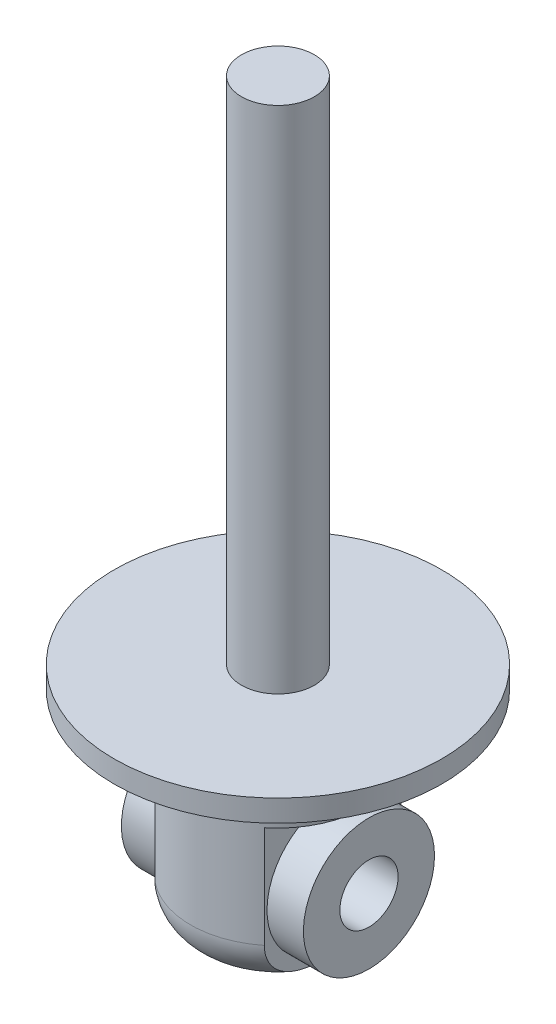
from build123d import *

# Parameters (mm, degrees)
SKETCH2_R               = 22.5
BOSS_EXTRUDE1_DEPTH     = 3
SKETCH3_R               = 5
BOSS_EXTRUDE2_DEPTH     = 70
SKETCH4_R               = 12
BOSS_EXTRUDE3_DEPTH     = 28
FILLET1_R               = 6
CUT_EXTRUDE1_DEPTH      = 80.633535649
CUT_EXTRUDE1_DEPTH_BACK = 80.633535649
SKETCH5_W               = 32.323012781
SKETCH5_H               = 20
CUT_EXTRUDE2_DEPTH      = 83.068568892
CUT_EXTRUDE2_DEPTH_BACK = 83.068568892
SKETCH6_R               = 4
SKETCH7_R               = 9
SKETCH7_R_2             = 4
BOSS_EXTRUDE4_DEPTH     = 12.5


with BuildPart() as part:
    # Sketch2 → Boss-Extrude1 (new body)
    with BuildSketch(Plane(origin=(0, 0, 0), x_dir=(1, 0, 0), z_dir=(0, 1, 0))):
        with Locations(Location((0, 0, 0), (0, 0, 270))):
            Circle(SKETCH2_R)
    extrude(amount=BOSS_EXTRUDE1_DEPTH)

    # Sketch3 → Boss-Extrude2 (add)
    with BuildSketch(Plane(origin=(0, 3, 0), x_dir=(1, 0, 0), z_dir=(0, 1, 0))):
        with Locations(Location((0, 0, 0), (0, 0, 270))):
            Circle(SKETCH3_R)
    extrude(amount=BOSS_EXTRUDE2_DEPTH)

    # Sketch4 → Boss-Extrude3 (add)
    with BuildSketch(Plane.XZ):
        with Locations(Location((0, 0, 0), (0, 0, 270))):
            Circle(SKETCH4_R)
    extrude(amount=BOSS_EXTRUDE3_DEPTH)

    # Fillet1
    fillet1_edges = [part.edges().sort_by_distance(p)[0] for p in [
        (0, -28, 12),
    ]]
    fillet(fillet1_edges, radius=FILLET1_R)

    # Sketch5 → Cut-Extrude1 (cut, two sides: drawn at the far end of the back side and taken through both)
    with BuildSketch(Plane.XY.offset(-CUT_EXTRUDE1_DEPTH_BACK)):
        with Locations((23.661506391, -18)):
            Rectangle(SKETCH5_W, SKETCH5_H)
        with Locations((-23.661506391, -18)):
            Rectangle(SKETCH5_W, SKETCH5_H)
    extrude(amount=CUT_EXTRUDE1_DEPTH + CUT_EXTRUDE1_DEPTH_BACK, mode=Mode.SUBTRACT)

    # Sketch6 → Cut-Extrude2 (cut, two sides: drawn at the far end of the back side and taken through both)
    with BuildSketch(Plane(origin=(7.5, 0, 0), x_dir=(0, 0, -1), z_dir=(1, 0, 0)).offset(-CUT_EXTRUDE2_DEPTH_BACK)):
        with Locations(Location((0, -18, 0), (0, 0, 90))):
            Circle(SKETCH6_R)
    extrude(amount=CUT_EXTRUDE2_DEPTH + CUT_EXTRUDE2_DEPTH_BACK, mode=Mode.SUBTRACT)

    # Sketch7 → Boss-Extrude4 (add, symmetric)
    with BuildSketch(Plane(origin=(0, 0, 0), x_dir=(0, 0, -1), z_dir=(1, 0, 0))):
        with Locations(Location((0, -18, 0), (0, 0, 270))):
            Circle(SKETCH7_R)
        with Locations(Location((0, -18, 0), (0, 0, 90))):
            Circle(SKETCH7_R_2, mode=Mode.SUBTRACT)
    extrude(amount=BOSS_EXTRUDE4_DEPTH, both=True)


solid = part.part
